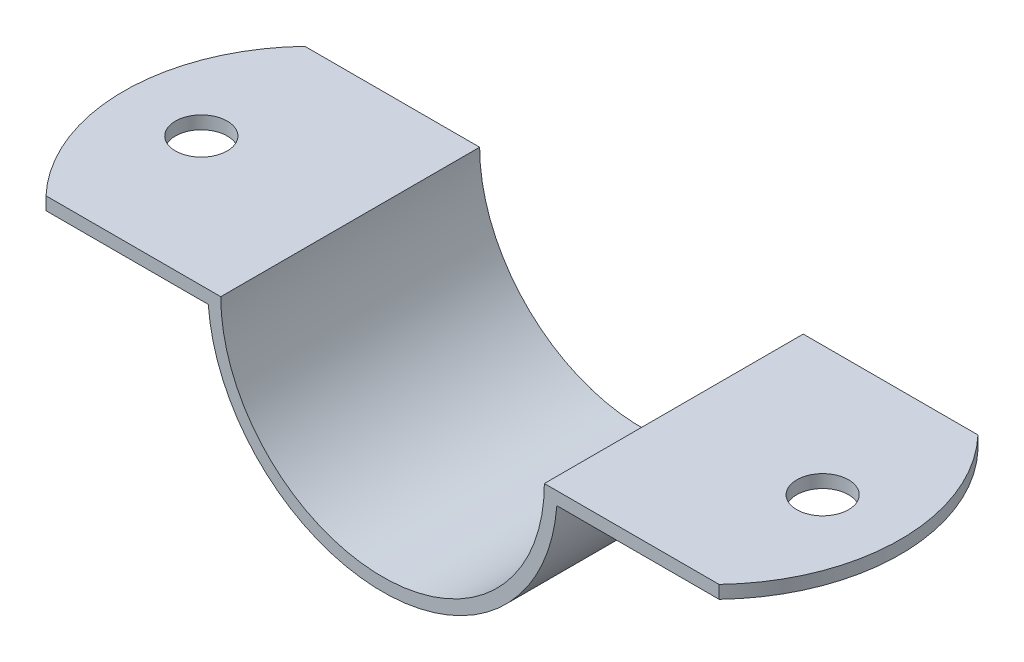
from build123d import *

# Parameters (mm, degrees)
BOSS_EXTRUDE1_DEPTH   = 20
SKETCH2_R             = 2
CUT_EXTRUDE1_DEPTH    = 20
SKETCH3_R             = 2
BOSS_EXTRUDE3_DEPTH   = 20
BOSS_EXTRUDE3_2_DEPTH = 20
CUT_EXTRUDE3_START    = -20
SKETCH4_R             = 2
CUT_EXTRUDE3_DEPTH    = 20
CUT_EXTRUDE4_START    = -29
SKETCH4_2_R           = 2
CUT_EXTRUDE4_DEPTH    = 29
CUT_EXTRUDE6_START    = -20
CUT_EXTRUDE6_DEPTH    = 20
BOSS_EXTRUDE4_START   = -1
BOSS_EXTRUDE4_DEPTH   = 1
BOSS_EXTRUDE5_START   = -1
SKETCH7_R             = 2
BOSS_EXTRUDE5_DEPTH   = 1
SKETCH8_R             = 2
CUT_EXTRUDE7_DEPTH    = 1


with BuildPart() as part:
    # Sketch1 → Boss-Extrude1 (new body)
    with BuildSketch(Plane.XY):
        with BuildLine():
            Line((12.5, 0), (30, 0))
            Line((30, 0), (30, -1))
            Line((30, -1), (13.462912018, -1))
            ThreePointArc((13.462912018, -1), (0, -13.5), (-13.462912018, -1))
            Line((-13.462912018, -1), (-30, -1))
            Line((-30, -1), (-30, 0))
            Line((-30, 0), (-12.5, 0))
            ThreePointArc((-12.5, 0), (0, -12.5), (12.5, 0))
        make_face()
    extrude(amount=BOSS_EXTRUDE1_DEPTH)

    # Sketch2 → Cut-Extrude1 (cut)
    with BuildSketch(Plane(origin=(0, 0, 0), x_dir=(1, 0, 0), z_dir=(0, 1, 0))):
        with BuildLine():
            Line((30, 0), (26, 0))
            ThreePointArc((26, 0), (28.962912018, -4.614835193), (30, -10))
            Line((30, -10), (30, 0))
        make_face()
        with BuildLine():
            ThreePointArc((30, -10), (28.962912018, -15.385164807), (26, -20))
            Line((26, -20), (30, -20))
            Line((30, -20), (30, -10))
        make_face()
        with BuildLine():
            Line((-30, 0), (-30, -9.99999978))
            ThreePointArc((-30, -9.99999978), (-28.962911977, -4.614835091), (-26, 0))
            Line((-26, 0), (-30, 0))
        make_face()
        with BuildLine():
            Line((-30, -20), (-26, -20))
            ThreePointArc((-26, -20), (-28.962912059, -15.385164705), (-30, -9.99999978))
            Line((-30, -9.99999978), (-30, -20))
        make_face()
        with Locations((-26, -10)):
            Circle(SKETCH2_R)
        with Locations((20, -10)):
            Circle(SKETCH2_R)
    extrude(amount=-CUT_EXTRUDE1_DEPTH, mode=Mode.SUBTRACT)

    # Sketch4<2> → Cut-Extrude4 (cut)
    with BuildSketch(Plane.XZ.offset(21).offset(CUT_EXTRUDE4_START)):
        with Locations((20, 10)):
            Circle(SKETCH4_2_R)
        with Locations((-24, 10)):
            Circle(SKETCH4_2_R)
    extrude(amount=CUT_EXTRUDE4_DEPTH, mode=Mode.SUBTRACT)

    # Sketch6 → Boss-Extrude4 (add)
    with BuildSketch(Plane.XZ.offset(1).offset(BOSS_EXTRUDE4_START)):
        with BuildLine():
            ThreePointArc((-25, 8.267949192), (-26, 10), (-25, 11.732050808))
            ThreePointArc((-25, 11.732050808), (-28, 10), (-25, 8.267949192))
        make_face()
    extrude(amount=BOSS_EXTRUDE4_DEPTH)

    # Sketch7 → Boss-Extrude5 (add)
    with BuildSketch(Plane.XZ.offset(1).offset(BOSS_EXTRUDE5_START)):
        with Locations((20, 10)):
            Circle(SKETCH7_R)
    extrude(amount=BOSS_EXTRUDE5_DEPTH)

    # Sketch8 → Cut-Extrude7 (cut)
    with BuildSketch(Plane.XZ.offset(1)):
        with Locations((24, 10)):
            Circle(SKETCH8_R)
    extrude(amount=-CUT_EXTRUDE7_DEPTH, mode=Mode.SUBTRACT)


with BuildPart() as body_2:
    # Sketch3 → Boss-Extrude3 (new body)
    with BuildSketch(Plane.XZ.offset(1)):
        with Locations((20, 10)):
            Circle(SKETCH3_R)
    extrude(amount=BOSS_EXTRUDE3_DEPTH)

    # Sketch4 → Cut-Extrude3 (cut)
    with BuildSketch(Plane.XZ.offset(21).offset(CUT_EXTRUDE3_START)):
        with Locations((20, 10)):
            Circle(SKETCH4_R)
        with Locations((-24, 10)):
            Circle(SKETCH4_R)
    extrude(amount=CUT_EXTRUDE3_DEPTH, mode=Mode.SUBTRACT)


with BuildPart() as body_3:
    # Sketch3 → Boss-Extrude3 2 (new body)
    with BuildSketch(Plane.XZ.offset(1)):
        with BuildLine():
            ThreePointArc((-25, 8.267949192), (-26, 10), (-25, 11.732050808))
            ThreePointArc((-25, 11.732050808), (-28, 10), (-25, 8.267949192))
        make_face()
    extrude(amount=BOSS_EXTRUDE3_2_DEPTH)

    # Sketch5 → Cut-Extrude6 (cut)
    with BuildSketch(Plane.XZ.offset(21).offset(CUT_EXTRUDE6_START)):
        with BuildLine():
            ThreePointArc((-25, 8.267949192), (-26, 10), (-25, 11.732050808))
            ThreePointArc((-25, 11.732050808), (-28, 10), (-25, 8.267949192))
        make_face()
    extrude(amount=CUT_EXTRUDE6_DEPTH, mode=Mode.SUBTRACT)


solid = part.part
